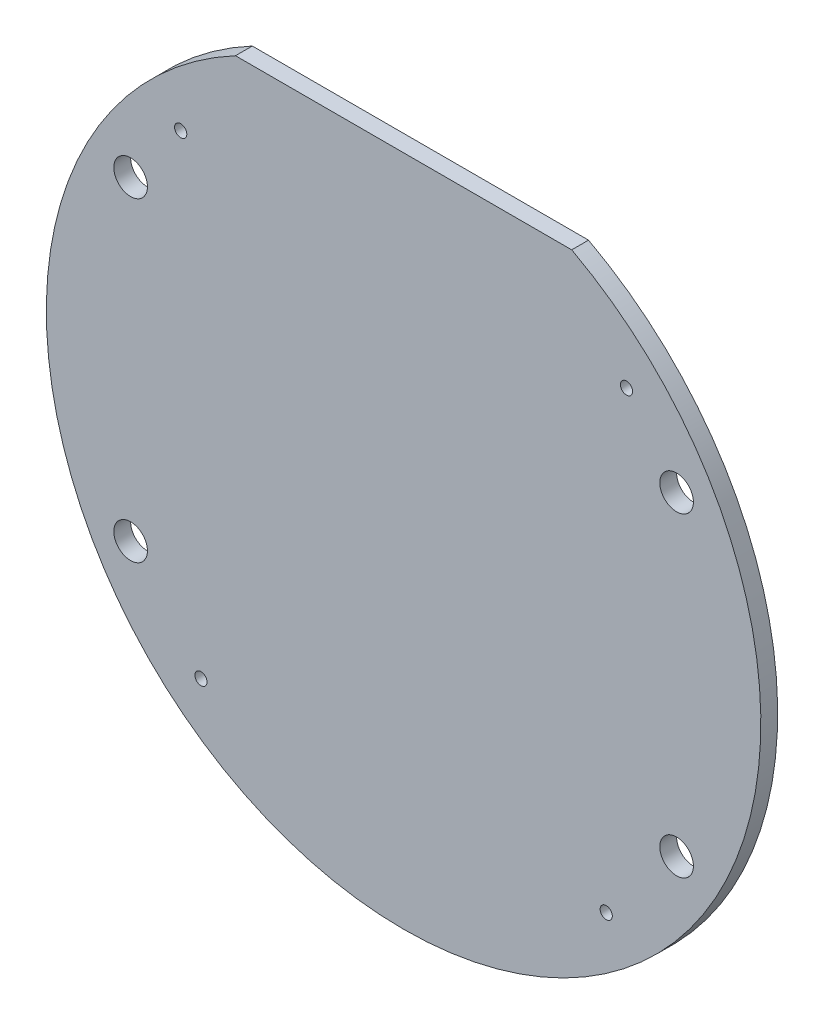
from build123d import *

# Parameters (mm, degrees)
RESSALTO_EXTRUS_O1_DEPTH      = 4
FURO_COM_FOLGA_DE_M2_51_D     = 2.9
FURO_COM_FOLGA_DE_M2_51_DEPTH = 7.25
FURO_COM_FOLGA_DE_M2_51_TIP   = 0.871247898
FUROS_GUIA_COM_8_0MM1_D       = 8
FUROS_GUIA_COM_8_0MM1_DEPTH   = 7.25
FUROS_GUIA_COM_8_0MM1_TIP     = 2.403442476


with BuildPart() as part:
    # Esboço1 → Ressalto-extrusão1 (new body)
    with BuildSketch(Plane.XY):
        with BuildLine():
            Line((-40, 75), (40, 75))
            ThreePointArc((40, 75), (0, -85), (-40, 75))
        make_face()
    extrude(amount=RESSALTO_EXTRUS_O1_DEPTH)

    # Furo com folga de M2.51
    with Locations(Plane(origin=(-53.033008589, 53.033008589, 4), x_dir=(1, 0, 0), z_dir=(0, 0, 1))):
        with Locations((0, 0), (106.066017178, 0), (101.242079315, -110.486341823), (4.823937863, -110.486341823)):
            Hole(FURO_COM_FOLGA_DE_M2_51_D / 2, depth=FURO_COM_FOLGA_DE_M2_51_DEPTH)
            with Locations((0, 0, -(FURO_COM_FOLGA_DE_M2_51_DEPTH + FURO_COM_FOLGA_DE_M2_51_TIP / 2))):  # 118° drill point
                Cone(0, FURO_COM_FOLGA_DE_M2_51_D / 2, FURO_COM_FOLGA_DE_M2_51_TIP, mode=Mode.SUBTRACT)

    # Furos-guia com Ø8.0mm1
    with Locations(Plane(origin=(-64.951905284, 37.5, 4), x_dir=(1, 0, 0), z_dir=(0, 0, 1))):
        with Locations((0, 0), (0, -75), (129.903810568, 0), (129.903810568, -75)):
            Hole(FUROS_GUIA_COM_8_0MM1_D / 2, depth=FUROS_GUIA_COM_8_0MM1_DEPTH)
            with Locations((0, 0, -(FUROS_GUIA_COM_8_0MM1_DEPTH + FUROS_GUIA_COM_8_0MM1_TIP / 2))):  # 118° drill point
                Cone(0, FUROS_GUIA_COM_8_0MM1_D / 2, FUROS_GUIA_COM_8_0MM1_TIP, mode=Mode.SUBTRACT)


solid = part.part
